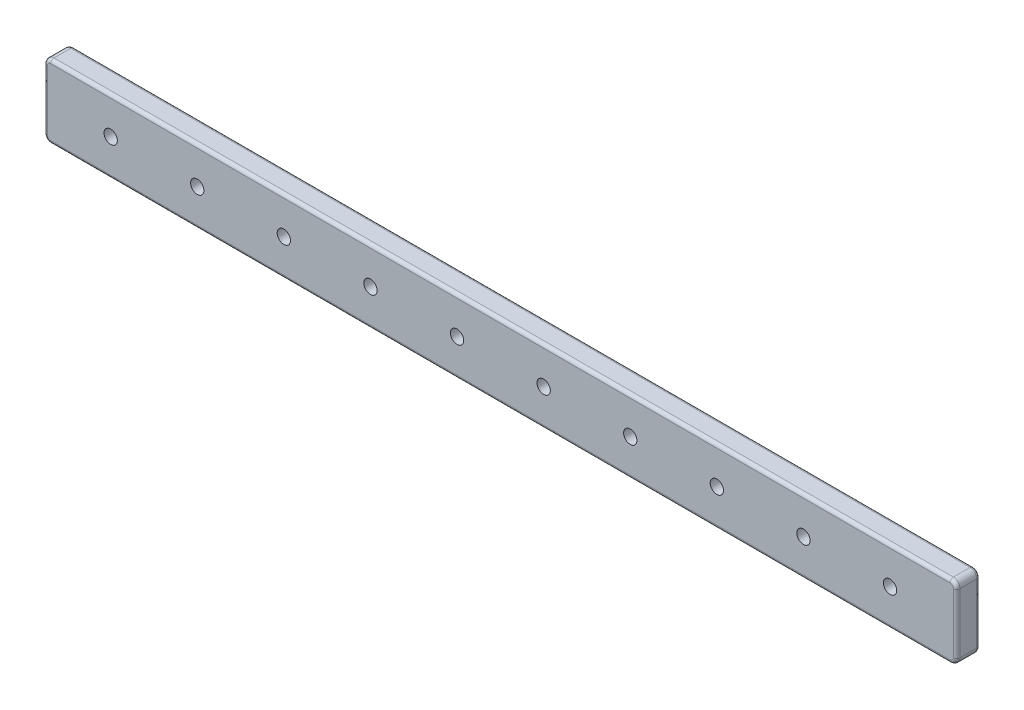
from build123d import *

# Parameters (mm, degrees)
SKETCH1_W           = 137
SKETCH1_H           = 11
BOSS_EXTRUDE1_DEPTH = 3.5
SKETCH2_R           = 1
CUT_EXTRUDE1_DEPTH  = 3.5
FILLET1_R           = 1
FILLET2_R           = 0.5


with BuildPart() as part:
    # Sketch1 → Boss-Extrude1 (new body)
    with BuildSketch(Plane.XY):
        with Locations((25.703809524, 9.635238095)):
            Rectangle(SKETCH1_W, SKETCH1_H)
    extrude(amount=BOSS_EXTRUDE1_DEPTH)

    # Sketch2 → Cut-Extrude1 (cut)
    with BuildSketch(Plane(origin=(0, 0, 0), x_dir=(-1, 0, 0), z_dir=(0, 0, -1))):
        with Locations((-84.203809524, 9.635238095)):
            Circle(SKETCH2_R)
        with Locations((-71.203809524, 9.635238095)):
            Circle(SKETCH2_R)
        with Locations((-58.203809524, 9.635238095)):
            Circle(SKETCH2_R)
        with Locations((-45.203809524, 9.635238095)):
            Circle(SKETCH2_R)
        with Locations((-32.203809524, 9.635238095)):
            Circle(SKETCH2_R)
        with Locations((-19.203809524, 9.635238095)):
            Circle(SKETCH2_R)
        with Locations((-6.203809524, 9.635238095)):
            Circle(SKETCH2_R)
        with Locations((6.796190476, 9.635238095)):
            Circle(SKETCH2_R)
        with Locations((19.796190476, 9.635238095)):
            Circle(SKETCH2_R)
        with Locations((32.796190476, 9.635238095)):
            Circle(SKETCH2_R)
    extrude(amount=-CUT_EXTRUDE1_DEPTH, mode=Mode.SUBTRACT)

    # Fillet1
    fillet1_edges = [part.edges().sort_by_distance(p)[0] for p in [
        (-42.796190476, 15.135238095, 1.75),
        (94.203809524, 15.135238095, 1.75),
        (94.203809524, 4.135238095, 1.75),
        (-42.796190476, 4.135238095, 1.75),
    ]]
    fillet(fillet1_edges, radius=FILLET1_R)

    # Fillet2
    fillet2_edges = [part.edges().sort_by_distance(p)[0] for p in [
        (25.703809524, 4.135238095, 0),
        (25.703809524, 4.135238095, 3.5),
        (-42.796190476, 9.635238095, 0),
        (25.703809524, 15.135238095, 0),
        (94.203809524, 9.635238095, 0),
        (93.910916305, 14.842344876, 0),
        (93.910916305, 4.428131314, 0),
        (-42.503297257, 14.842344876, 0),
        (-42.503297257, 4.428131314, 0),
        (-42.796190476, 9.635238095, 3.5),
        (94.203809524, 9.635238095, 3.5),
        (25.703809524, 15.135238095, 3.5),
        (93.910916305, 14.842344876, 3.5),
        (93.910916305, 4.428131314, 3.5),
        (-42.503297257, 14.842344876, 3.5),
        (-42.503297257, 4.428131314, 3.5),
    ]]
    fillet(fillet2_edges, radius=FILLET2_R)


solid = part.part
